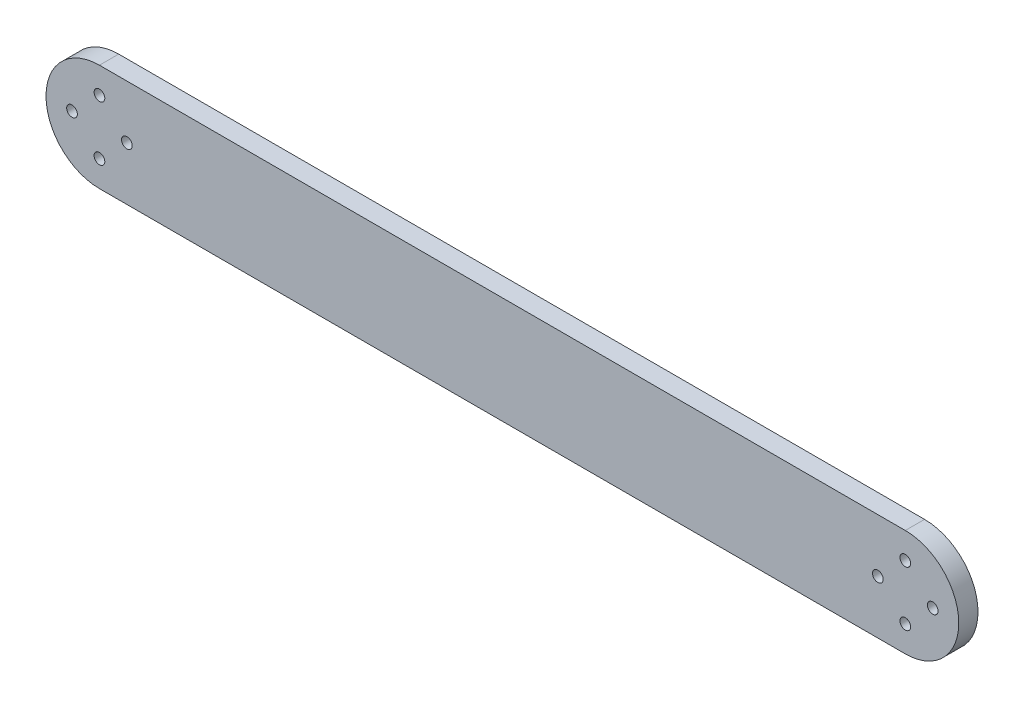
from build123d import *

# Parameters (mm, degrees)
SKETCH1_R           = 1.5
BOSS_EXTRUDE1_DEPTH = 5.4


with BuildPart() as part:
    # Sketch1 → Boss-Extrude1 (new body)
    with BuildSketch(Plane.XY):
        with BuildLine():
            Line((0, -15), (226.153846154, -15))
            ThreePointArc((226.153846154, -15), (241.153846154, 0), (226.153846154, 15))
            Line((226.153846154, 15), (0, 15))
            ThreePointArc((0, 15), (-15, 0), (0, -15))
        make_face()
        with Locations((0, 7.7)):
            Circle(SKETCH1_R, mode=Mode.SUBTRACT)
        with Locations((7.7, 0)):
            Circle(SKETCH1_R, mode=Mode.SUBTRACT)
        with Locations((0, -7.7)):
            Circle(SKETCH1_R, mode=Mode.SUBTRACT)
        with Locations((-7.7, 0)):
            Circle(SKETCH1_R, mode=Mode.SUBTRACT)
        with Locations((218.453846154, 0)):
            Circle(SKETCH1_R, mode=Mode.SUBTRACT)
        with Locations((226.153846154, -7.7)):
            Circle(SKETCH1_R, mode=Mode.SUBTRACT)
        with Locations((233.853846154, 0)):
            Circle(SKETCH1_R, mode=Mode.SUBTRACT)
        with Locations((226.153846154, 7.7)):
            Circle(SKETCH1_R, mode=Mode.SUBTRACT)
    extrude(amount=BOSS_EXTRUDE1_DEPTH)


solid = part.part
